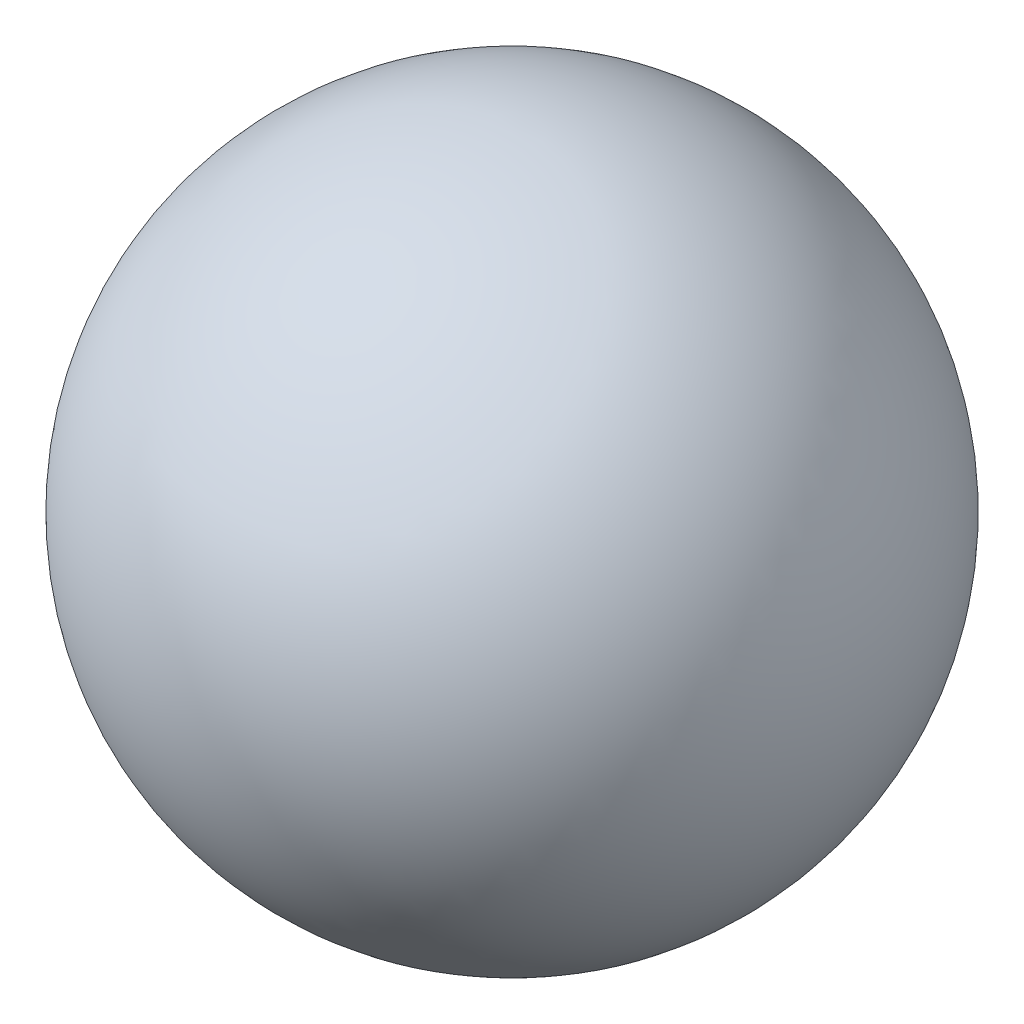
from build123d import *

# Parameters (mm, degrees)
SCALE1_SCALE = 0.5
SCALE2_SCALE = 1.25
SCALE3_SCALE = 1.1


with BuildPart() as part:
    # Sketch1 → Revolve1 (revolve)
    with BuildSketch(Plane.XY):
        with BuildLine():
            Line((0, 6), (0, -6))
            ThreePointArc((0, -6), (6, 0), (0, 6))
        make_face()
    revolve(axis=Axis((0, 12.472258692, 0), (0, -1, 0)))


with BuildPart() as part_1:
    # Scale1: scaled about (0, 0, 0)
    add(part.part.scale(SCALE1_SCALE))


with BuildPart() as part_2:
    # Scale2: scaled about (0, 0, 0)
    add(part_1.part.scale(SCALE2_SCALE))


with BuildPart() as part_3:
    # Scale3: scaled about (0, 0, 0)
    add(part_2.part.scale(SCALE3_SCALE))


solid = part_3.part
